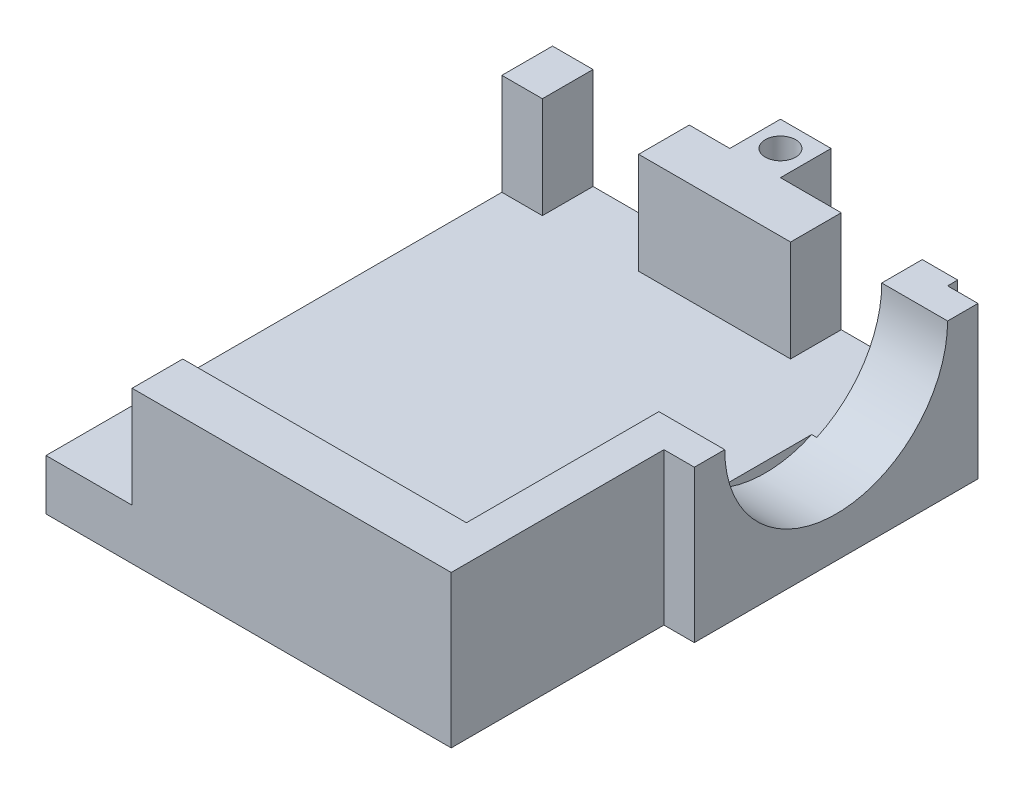
from build123d import *

# Parameters (mm, degrees)
SKETCH1_W           = 40
SKETCH1_H           = 50
BOSS_EXTRUDE1_DEPTH = 5
SKETCH4_W           = 15
SKETCH4_H           = 5
SKETCH4_W_2         = 4
SKETCH4_W_3         = 5
BOSS_EXTRUDE5_DEPTH = 10
CUT_EXTRUDE2_DEPTH  = 4
BOSS_EXTRUDE7_START = 3
BOSS_EXTRUDE7_DEPTH = 3
SKETCH9_W           = 5
SKETCH9_H           = 5
BOSS_EXTRUDE8_DEPTH = 5
SKETCH10_R          = 1.5
CUT_EXTRUDE3_DEPTH  = 5


with BuildPart() as part:
    # Sketch1 → Boss-Extrude1 (new body)
    with BuildSketch(Plane(origin=(0, 0, 0), x_dir=(1, 0, 0), z_dir=(0, 1, 0))):
        Rectangle(SKETCH1_W, SKETCH1_H)
    extrude(amount=BOSS_EXTRUDE1_DEPTH)

    # Sketch4 → Boss-Extrude5 (add)
    with BuildSketch(Plane(origin=(0, 5, 0), x_dir=(1, 0, 0), z_dir=(0, 1, 0))):
        Polygon((20, -25), (20, 25), (16.5, 25), (16.5, -20), (-6.5, -20), (-6.5, -25), align=None)
        with Locations((1, 22.5)):
            Rectangle(SKETCH4_W, SKETCH4_H)
        with Locations((-18, 22.5)):
            Rectangle(SKETCH4_W_2, SKETCH4_H)
        with Locations((-9, -22.5)):
            Rectangle(SKETCH4_W_3, SKETCH4_H)
    extrude(amount=BOSS_EXTRUDE5_DEPTH)

    # Sketch7 → Cut-Extrude2 (cut)
    with BuildSketch(Plane(origin=(20, 0, 0), x_dir=(0, 0, -1), z_dir=(1, 0, 0))):
        with BuildLine():
            Line((-1, 15), (21, 15))
            ThreePointArc((21, 15), (10, 4), (-1, 15))
        make_face()
    extrude(amount=-CUT_EXTRUDE2_DEPTH, mode=Mode.SUBTRACT)

    # Sketch8 → Boss-Extrude7 (add)
    with BuildSketch(Plane(origin=(20, 0, 0), x_dir=(0, 0, -1), z_dir=(1, 0, 0)).offset(BOSS_EXTRUDE7_START)):
        with BuildLine():
            Line((-1, 15), (-4, 15))
            Line((-4, 15), (-4, 0))
            Line((-4, 0), (24, 0))
            Line((24, 0), (24, 15))
            Line((24, 15), (21, 15))
            ThreePointArc((21, 15), (10, 4), (-1, 15))
        make_face()
    extrude(amount=-BOSS_EXTRUDE7_DEPTH)

    # Sketch9 → Boss-Extrude8 (add)
    with BuildSketch(Plane(origin=(0, 0, -25), x_dir=(-1, 0, 0), z_dir=(0, 0, -1))):
        with Locations((0, 12.5)):
            Rectangle(SKETCH9_W, SKETCH9_H)
    extrude(amount=BOSS_EXTRUDE8_DEPTH)

    # Sketch10 → Cut-Extrude3 (cut)
    with BuildSketch(Plane.XZ.offset(-10)):
        with Locations(Location((0, -27.5, 0), (0, 0, 270))):
            Circle(SKETCH10_R)
    extrude(amount=-CUT_EXTRUDE3_DEPTH, mode=Mode.SUBTRACT)


solid = part.part
